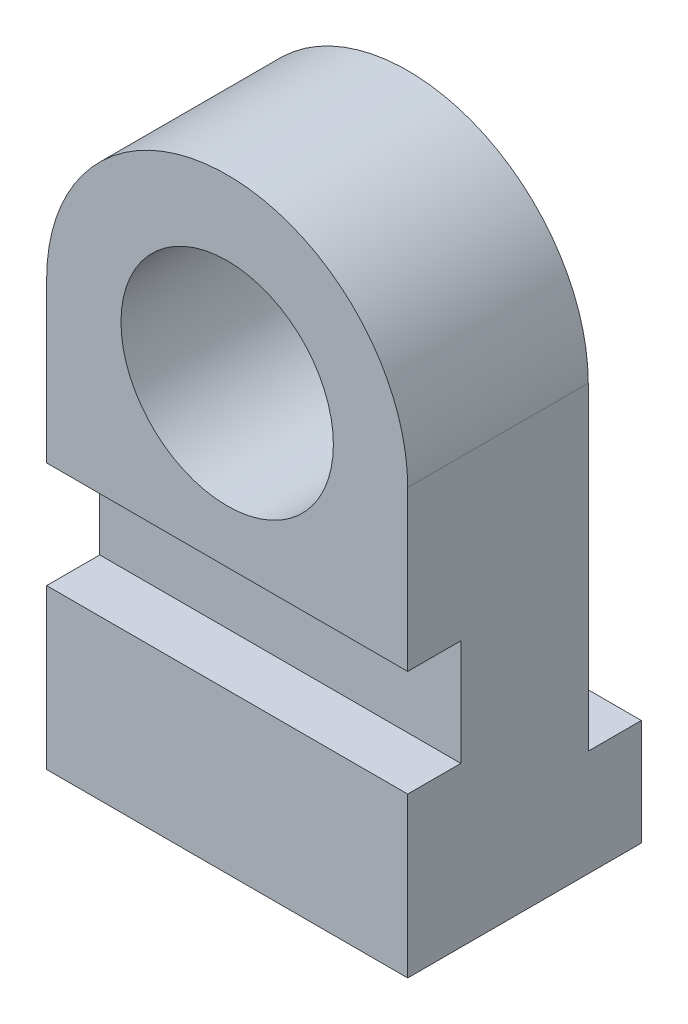
from build123d import *

# Parameters (mm, degrees)
SKETCH1_R           = 10000
BOSS_EXTRUDE1_DEPTH = 17000
SKETCH2_W           = 34000
SKETCH2_H           = 10000
CUT_EXTRUDE1_DEPTH  = 5000
SKETCH3_W           = 34000
SKETCH3_H           = 10000
BOSS_EXTRUDE2_DEPTH = 5000


with BuildPart() as part:
    # Sketch1 → Boss-Extrude1 (new body)
    with BuildSketch(Plane.XY):
        with BuildLine():
            Line((-49465.753424658, 40000), (-49465.753424658, 0))
            Line((-49465.753424658, 0), (-15465.753424658, 0))
            Line((-15465.753424658, 0), (-15465.753424658, 40000))
            ThreePointArc((-15465.753424658, 40000), (-32465.753424658, 57000), (-49465.753424658, 40000))
        make_face()
        with Locations((-32465.753424658, 40000)):
            Circle(SKETCH1_R, mode=Mode.SUBTRACT)
    extrude(amount=BOSS_EXTRUDE1_DEPTH)

    # Sketch2 → Cut-Extrude1 (cut)
    with BuildSketch(Plane.XY.offset(17000)):
        with Locations((-32465.753424658, 20000)):
            Rectangle(SKETCH2_W, SKETCH2_H)
    extrude(amount=-CUT_EXTRUDE1_DEPTH, mode=Mode.SUBTRACT)

    # Sketch3 → Boss-Extrude2 (add)
    with BuildSketch(Plane(origin=(0, 0, 0), x_dir=(-1, 0, 0), z_dir=(0, 0, -1))):
        with Locations((32465.753424658, 5000)):
            Rectangle(SKETCH3_W, SKETCH3_H)
    extrude(amount=BOSS_EXTRUDE2_DEPTH)


solid = part.part
